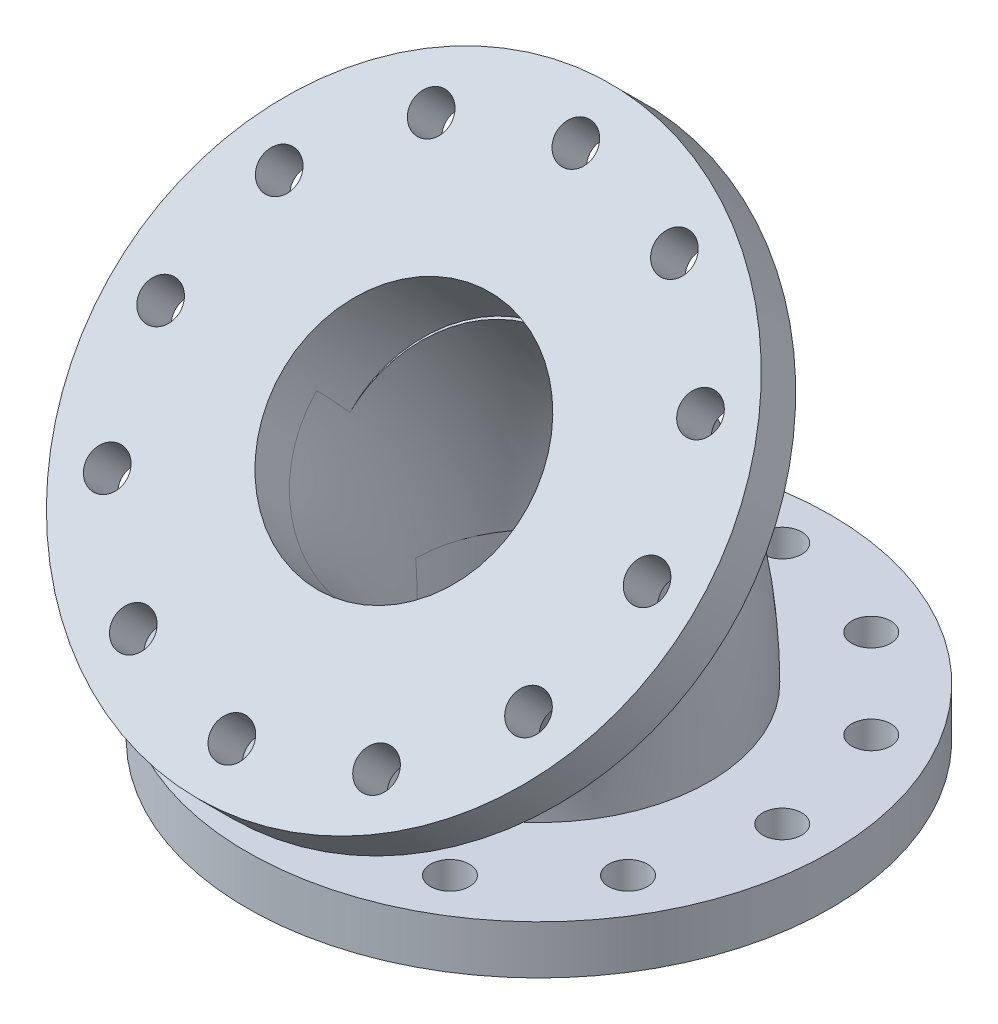
from build123d import *

# Parameters (mm, degrees)
SKETCH17_R              = 35
SKETCH18_R              = 60
BOSS_EXTRUDE2_DEPTH     = 10
SKETCH19_R              = 60
BOSS_EXTRUDE3_DEPTH     = 10
CUT_EXTRUDE1_DEPTH      = 153.968934548
CUT_EXTRUDE1_DEPTH_BACK = 10
SKETCH20_R              = 4
SKETCH21_R              = 25
CUT_EXTRUDE3_DEPTH      = 153.968934548
CUT_EXTRUDE3_DEPTH_BACK = 10
SKETCH21_3_R            = 25
SKETCH22_R              = 25
CUT_EXTRUDE10_DEPTH     = 10
CUT_EXTRUDE11_START     = 10
SKETCH22_3_R            = 25
CUT_EXTRUDE11_DEPTH     = 10
SKETCH24_R              = 4
CUT_EXTRUDE18_DEPTH     = 10


with BuildPart() as part:
    # Sweep1: sweep along a path in Sketch16
    with BuildLine(Plane(origin=(0, 0, 0), x_dir=(0, 0, -1), z_dir=(1, 0, 0))) as sweep1_path:
        ThreePointArc((0, 0), (-7.612046749, 38.268343237), (-29.289321881, 70.710678119))
    # Sketch17 → Sweep1 (sweep)
    with BuildSketch(Plane(origin=(0, 0, 0), x_dir=(1, 0, 0), z_dir=(0, 1, 0))):
        with Locations((0, -29.289321881)):
            Circle(SKETCH17_R)
    sweep(path=sweep1_path.line)

    # Sketch18 → Boss-Extrude2 (add)
    with BuildSketch(Plane(origin=(0, 0, 0), x_dir=(-1, 0, 0), z_dir=(0, -1, 0))):
        with Locations(Location((0, -29.289321881, 0), (0, 0, 90))):
            Circle(SKETCH18_R)
    extrude(amount=BOSS_EXTRUDE2_DEPTH)

    # Sketch19 → Boss-Extrude3 (add)
    with BuildSketch(Plane(origin=(0, 50, 50), x_dir=(1, 0, 0), z_dir=(0, 0.7071067811865513, 0.7071067811865438))):
        with Locations(Location((0, 0, 0), (0, 0, 270))):
            Circle(SKETCH19_R)
    extrude(amount=BOSS_EXTRUDE3_DEPTH)

    # Sketch20 → Cut-Extrude1 (cut, two sides: drawn at the far end of the back side and taken through both)
    with BuildSketch(Plane(origin=(0, 0, 0), x_dir=(-1, 0, 0), z_dir=(0, -1, 0)).offset(-CUT_EXTRUDE1_DEPTH_BACK)):
        with Locations(Location((0, 20.710678119, 0), (0, 0, 90))):
            Circle(SKETCH20_R)
        with Locations(Location((25, 14.011948308, 0), (0, 0, 90))):
            Circle(SKETCH20_R)
        with Locations(Location((43.301270189, -4.289321881, 0), (0, 0, 90))):
            Circle(SKETCH20_R)
        with Locations(Location((50, -29.289321881, 0), (0, 0, 90))):
            Circle(SKETCH20_R)
        with Locations(Location((43.301270189, -54.289321881, 0), (0, 0, 90))):
            Circle(SKETCH20_R)
        with Locations(Location((25, -72.590592071, 0), (0, 0, 90))):
            Circle(SKETCH20_R)
        with Locations(Location((0, -79.289321881, 0), (0, 0, 90))):
            Circle(SKETCH20_R)
        with Locations(Location((-25, -72.590592071, 0), (0, 0, 90))):
            Circle(SKETCH20_R)
        with Locations(Location((-43.301270189, -54.289321881, 0), (0, 0, 90))):
            Circle(SKETCH20_R)
        with Locations(Location((-50, -29.289321881, 0), (0, 0, 90))):
            Circle(SKETCH20_R)
        with Locations(Location((-43.301270189, -4.289321881, 0), (0, 0, 90))):
            Circle(SKETCH20_R)
        with Locations(Location((-25, 14.011948308, 0), (0, 0, 90))):
            Circle(SKETCH20_R)
    extrude(amount=CUT_EXTRUDE1_DEPTH + CUT_EXTRUDE1_DEPTH_BACK, mode=Mode.SUBTRACT)

    # Cut-Sweep2: sweep along a path in Sketch16<3>
    with BuildLine(Plane(origin=(0, 0, 0), x_dir=(0, 0, -1), z_dir=(1, 0, 0))) as cut_sweep2_path:
        ThreePointArc((0, 0), (-7.612046749, 38.268343237), (-29.289321881, 70.710678119))
    # Sketch21 → Cut-Sweep2 (sweep, cut)
    with BuildSketch(Plane(origin=(0, 0, 0), x_dir=(-1, 0, 0), z_dir=(0, -1, 0))):
        with Locations((0, -29.289321881)):
            Circle(SKETCH21_R)
    sweep(path=cut_sweep2_path.line, mode=Mode.SUBTRACT)

    # Sketch21<3> → Cut-Extrude3 (cut, two sides: drawn at the far end of the back side and taken through both)
    with BuildSketch(Plane(origin=(0, 0, 0), x_dir=(-1, 0, 0), z_dir=(0, -1, 0)).offset(-CUT_EXTRUDE3_DEPTH_BACK)):
        with Locations(Location((0, -29.289321881, 0), (0, 0, 180.810311696))):
            Circle(SKETCH21_3_R)
    extrude(amount=CUT_EXTRUDE3_DEPTH + CUT_EXTRUDE3_DEPTH_BACK, mode=Mode.SUBTRACT)

    # Sketch22 → Cut-Extrude10 (cut)
    with BuildSketch(Plane(origin=(0, 50, 50), x_dir=(1, 0, 0), z_dir=(0, 0.7071067811865513, 0.7071067811865438))):
        Circle(SKETCH22_R)
    extrude(amount=-CUT_EXTRUDE10_DEPTH, mode=Mode.SUBTRACT)

    # Sketch22<3> → Cut-Extrude11 (cut)
    with BuildSketch(Plane(origin=(0, 50, 50), x_dir=(1, 0, 0), z_dir=(0, 0.7071067811865513, 0.7071067811865438)).offset(CUT_EXTRUDE11_START)):
        with Locations(Location((0, 0, 0), (0, 0, 270))):
            Circle(SKETCH22_3_R)
    extrude(amount=-CUT_EXTRUDE11_DEPTH, mode=Mode.SUBTRACT)

    # Sketch24 → Cut-Extrude18 (cut)
    with BuildSketch(Plane(origin=(0, 50, 50), x_dir=(1, 0, 0), z_dir=(0, 0.7071067811865513, 0.7071067811865438))):
        with Locations(Location((0, 50, 0), (0, 0, 270))):
            Circle(SKETCH24_R)
        with Locations(Location((25, 43.301270189, 0), (0, 0, 270))):
            Circle(SKETCH24_R)
        with Locations(Location((43.301270189, 25, 0), (0, 0, 270))):
            Circle(SKETCH24_R)
        with Locations(Location((50, 0, 0), (0, 0, 270))):
            Circle(SKETCH24_R)
        with Locations(Location((43.301270189, -25, 0), (0, 0, 270))):
            Circle(SKETCH24_R)
        with Locations(Location((25, -43.301270189, 0), (0, 0, 270))):
            Circle(SKETCH24_R)
        with Locations(Location((0, -50, 0), (0, 0, 270))):
            Circle(SKETCH24_R)
        with Locations(Location((-25, -43.301270189, 0), (0, 0, 270))):
            Circle(SKETCH24_R)
        with Locations(Location((-43.301270189, -25, 0), (0, 0, 270))):
            Circle(SKETCH24_R)
        with Locations(Location((-50, 0, 0), (0, 0, 270))):
            Circle(SKETCH24_R)
        with Locations(Location((-43.301270189, 25, 0), (0, 0, 270))):
            Circle(SKETCH24_R)
        with Locations(Location((-25, 43.301270189, 0), (0, 0, 270))):
            Circle(SKETCH24_R)
    extrude(amount=CUT_EXTRUDE18_DEPTH, mode=Mode.SUBTRACT)


solid = part.part
